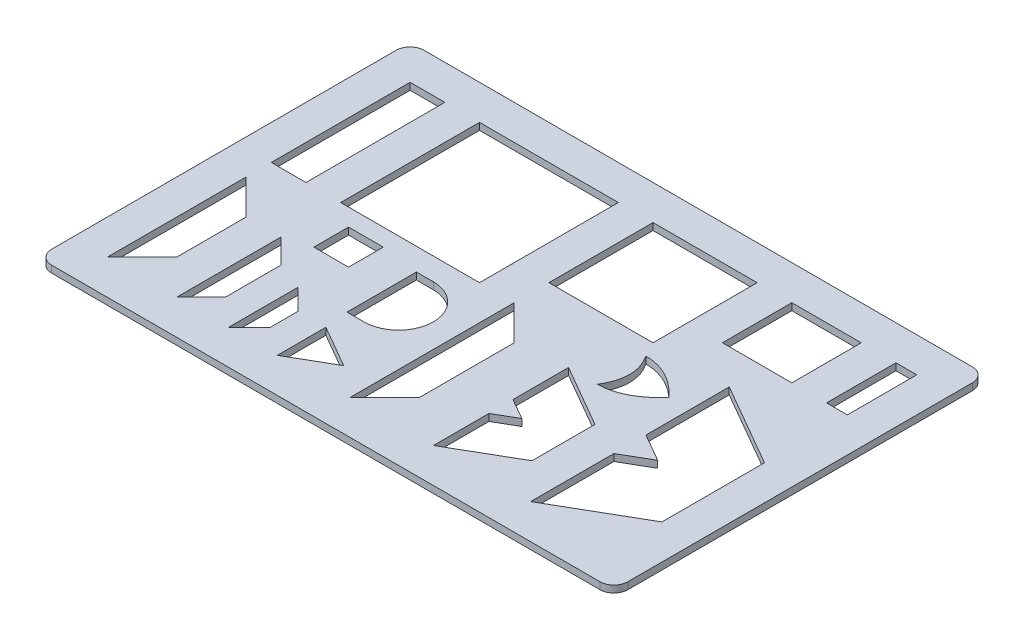
from build123d import *

# Parameters (mm, degrees)
SKETCH1_W           = 83
SKETCH1_H           = 53.635971978
SKETCH1_W_2         = 20
SKETCH1_H_2         = 20
SKETCH1_W_3         = 15
SKETCH1_H_3         = 15
SKETCH1_W_4         = 10
SKETCH1_H_4         = 10
SKETCH1_W_5         = 5
SKETCH1_W_6         = 3
SKETCH1_H_5         = 5
BOSS_EXTRUDE1_DEPTH = 1
FILLET1_R           = 2


with BuildPart() as part:
    # Sketch1 → Boss-Extrude1 (new body)
    with BuildSketch(Plane(origin=(0, 0, 0), x_dir=(1, 0, 0), z_dir=(0, 1, 0))):
        with Locations((-25.700677223, 6.877666185)):
            Rectangle(SKETCH1_W, SKETCH1_H)
        Polygon((-62.200677223, 5.059680196), (-62.200677223, -14.940319804), (-57.200677223, -9.940319804), (-57.200677223, 0.059680196), align=None, mode=Mode.SUBTRACT)
        with Locations((-42.200677223, 18.695652174)):
            Rectangle(SKETCH1_W_2, SKETCH1_H_2, mode=Mode.SUBTRACT)
        with Locations((-19.700677223, 21.195652174)):
            Rectangle(SKETCH1_W_3, SKETCH1_H_3, mode=Mode.SUBTRACT)
        with Locations((-2.200677223, 23.695652174)):
            Rectangle(SKETCH1_W_4, SKETCH1_H_4, mode=Mode.SUBTRACT)
        with Locations((-59.700677223, 18.695652174)):
            Rectangle(SKETCH1_W_5, SKETCH1_H_2, mode=Mode.SUBTRACT)
        with Locations((9.299322777, 23.695652174)):
            Rectangle(SKETCH1_W_6, SKETCH1_H_4, mode=Mode.SUBTRACT)
        Polygon((-52.200677223, -14.940319804), (-52.200677223, 0.059680196), (-48.700677223, -3.440319804), (-48.700677223, -11.440319804), align=None, mode=Mode.SUBTRACT)
        Polygon((-44.700677223, -4.940319804), (-44.700677223, -14.940319804), (-41.700677223, -11.940319804), (-41.700677223, -7.940319804), align=None, mode=Mode.SUBTRACT)
        Polygon((-1.200677223, 13.67848235), (-1.200677223, 1.67848235), (2.799322777, -0.630918727), (-1.200677223, -2.940319804), (-1.200677223, -14.940319804), (10.799322777, -8.012116573), (10.799322777, 6.750279119), align=None, mode=Mode.SUBTRACT)
        Polygon((-15.200677223, 4.523781811), (-15.200677223, -3.476218189), (-12.200677223, -5.208268996), (-15.200677223, -6.940319804), (-15.200677223, -14.940319804), (-6.200677223, -9.744167381), (-6.200677223, -0.672370611), align=None, mode=Mode.SUBTRACT)
        Polygon((-27.200677223, 8.695652174), (-27.200677223, -14.940319804), (-22.200677223, -9.940319804), (-22.200677223, 3.695652174), align=None, mode=Mode.SUBTRACT)
        Polygon((-37.700677223, -14.940319804), (-37.700677223, -7.940319804), (-31.638499397, -11.440319804), align=None, mode=Mode.SUBTRACT)
        with Locations((-46.067733945, 3.695652174)):
            Rectangle(SKETCH1_W_5, SKETCH1_H_5, mode=Mode.SUBTRACT)
        with BuildLine():
            Line((-35.634253982, 5.478469437), (-38.073838133, 5.478469437))
            Line((-38.073838133, 5.478469437), (-38.073838133, -4.521530563))
            Line((-38.073838133, -4.521530563), (-35.634253982, -4.521530563))
            ThreePointArc((-35.634253982, -4.521530563), (-30.634253982, 0.478469437), (-35.634253982, 5.478469437))
        make_face(mode=Mode.SUBTRACT)
        with BuildLine():
            add(Edge.make_bspline(
                [(-11.041888769, 11.517886634), (-8.809163486, 8.017886634), (-11.041888769, 4.517886634)],
                knots=[0, 0, 0, 1, 1, 1], degree=2))
            add(Edge.make_bspline(
                [(-11.041888769, 4.517886634), (-7.404142371, 4.517886634), (-4.201433986, 8.017886634)],
                knots=[0, 0, 0, 1, 1, 1], degree=2))
            add(Edge.make_bspline(
                [(-11.041888769, 11.517886634), (-7.453218548, 11.517886634), (-4.201433986, 8.017886634)],
                knots=[0, 0, 0, 1, 1, 1], degree=2))
        make_face(mode=Mode.SUBTRACT)
    extrude(amount=BOSS_EXTRUDE1_DEPTH)

    # Fillet1
    fillet1_edges = [part.edges().sort_by_distance(p)[0] for p in [
        (-67.200677223, 0.5, -33.695652174),
        (15.799322777, 0.5, -33.695652174),
        (15.799322777, 0.5, 19.940319804),
        (-67.200677223, 0.5, 19.940319804),
    ]]
    fillet(fillet1_edges, radius=FILLET1_R)


solid = part.part
